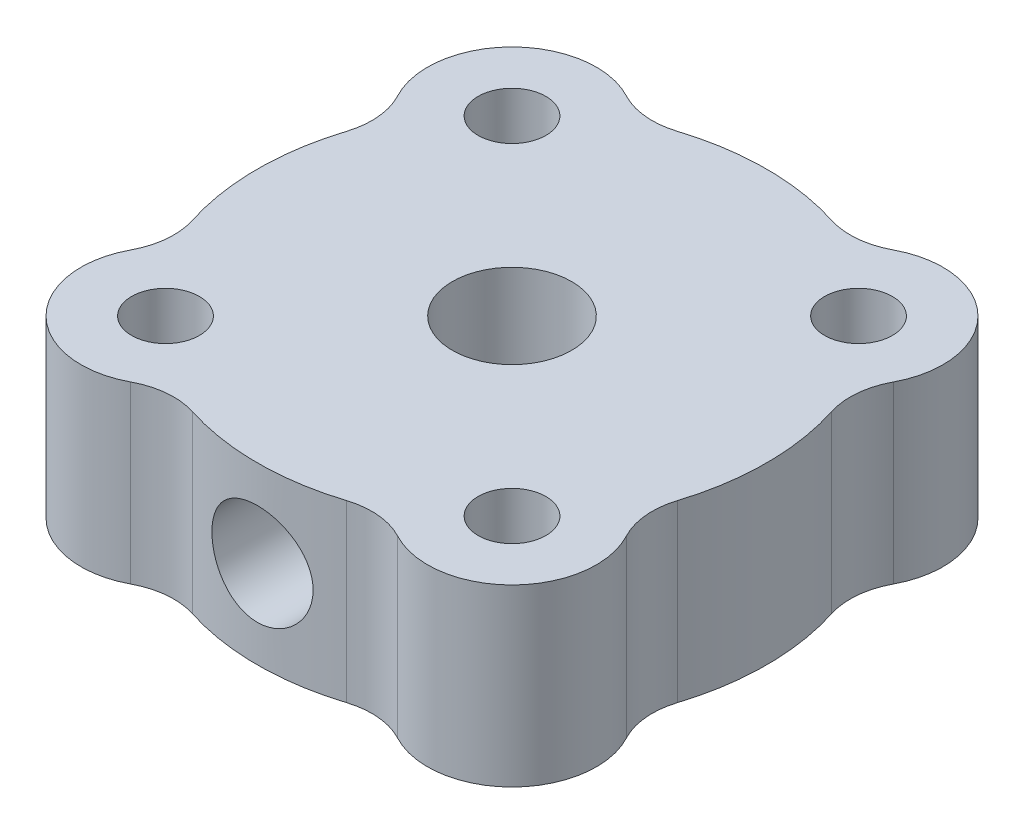
from build123d import *

# Parameters (mm, degrees)
BOSS_EXTRUDE1_DEPTH         = 6.985
BOSS_EXTRUDE2_DEPTH         = 6.985
BOSS_EXTRUDE3_DEPTH         = 6.985
BOSS_EXTRUDE4_START         = -6.985
BOSS_EXTRUDE4_DEPTH         = 6.985
SKETCH5_W                   = 6.35
SKETCH5_H                   = 2.54
M2_5_CLEARANCE_HOLE1_D      = 2.7051
M4_CLEARANCE_HOLE1_D        = 4.7625
M3_5_CLEARANCE_HOLE1_REACH  = 25.671
M3_5_CLEARANCE_HOLE1_BORE_R = 2.0193
FILLET1_R                   = 2.921


with BuildPart() as part:
    # Sketch1 → Boss-Extrude1 (new body)
    with BuildSketch(Plane.XZ.offset(-2.54)):
        with BuildLine():
            ThreePointArc((-4.397716486, 9.158913129), (-9.299304671, 9.299304671), (-9.158913129, 4.397716486))
            ThreePointArc((-9.158913129, 4.397716486), (7.184204897, -7.184204897), (-4.397716486, 9.158913129))
        make_face()
    extrude(amount=-BOSS_EXTRUDE1_DEPTH)

    # Sketch2 → Boss-Extrude2 (add)
    with BuildSketch(Plane.XZ.offset(-2.54)):
        with BuildLine():
            ThreePointArc((-9.158913129, -4.397716486), (-9.299304671, -9.299304671), (-4.397716486, -9.158913129))
            ThreePointArc((-4.397716486, -9.158913129), (-7.184204897, -7.184204897), (-9.158913129, -4.397716486))
        make_face()
    extrude(amount=-BOSS_EXTRUDE2_DEPTH)

    # Sketch3 → Boss-Extrude3 (add)
    with BuildSketch(Plane.XZ.offset(-2.54)):
        with BuildLine():
            ThreePointArc((4.397716486, -9.158913129), (9.299304671, -9.299304671), (9.158913129, -4.397716486))
            ThreePointArc((9.158913129, -4.397716486), (7.184204897, -7.184204897), (4.397716486, -9.158913129))
        make_face()
    extrude(amount=-BOSS_EXTRUDE3_DEPTH)

    # Sketch4 → Boss-Extrude4 (add)
    with BuildSketch(Plane(origin=(0, 9.525, 0), x_dir=(1, 0, 0), z_dir=(0, 1, 0)).offset(BOSS_EXTRUDE4_START)):
        with BuildLine():
            ThreePointArc((9.158913129, -4.397716486), (7.184204897, -7.184204897), (4.397716486, -9.158913129))
            ThreePointArc((4.397716486, -9.158913129), (9.299304671, -9.299304671), (9.158913129, -4.397716486))
        make_face()
    extrude(amount=BOSS_EXTRUDE4_DEPTH)

    # Sketch5 → Revolve1 (revolve)
    with BuildSketch(Plane.XY, mode=Mode.PRIVATE) as revolve1_sk:
        with Locations((3.175, 1.27)):
            Rectangle(SKETCH5_W, SKETCH5_H)
    revolve(revolve1_sk.sketch.rotate(Axis((0, 2.54, 0), (0, -1, 0)), 270), axis=Axis((0, 2.54, 0), (0, -1, 0)))

    # M2.5 Clearance Hole1 (through all)
    with Locations(Plane(origin=(0, 2.54, 0), x_dir=(-1, 0, 0), z_dir=(0, -1, 0))):
        with Locations((-6.914797213, 6.914797213), (-6.914797213, -6.914797213), (6.914797213, -6.914797213), (6.914797213, 6.914797213)):
            Hole(M2_5_CLEARANCE_HOLE1_D / 2)

    # M4 Clearance Hole1 (through all)
    with Locations(Plane(origin=(0, 0, 0), x_dir=(-1, 0, 0), z_dir=(0, -1, 0))):
        with Locations((0, 0)):
            Hole(M4_CLEARANCE_HOLE1_D / 2)

    # M3.5 Clearance Hole1 bore (on position points) → M3.5 Clearance Hole1 (cut, up to next)
    with BuildSketch(Plane(origin=(0, 6.0325, 10.16), x_dir=(1, 0, 0), z_dir=(0, 0, 1)), mode=Mode.PRIVATE) as m3_5_clearance_hole1_sk1:
        Circle(M3_5_CLEARANCE_HOLE1_BORE_R)
    m3_5_clearance_hole1_tool1 = extrude(m3_5_clearance_hole1_sk1.sketch, amount=-M3_5_CLEARANCE_HOLE1_REACH, mode=Mode.PRIVATE) & part.part
    add(m3_5_clearance_hole1_tool1.solids().sort_by_distance((0, 6.0325, 10.16))[0], mode=Mode.SUBTRACT)

    # Fillet1
    fillet1_edges = [part.edges().sort_by_distance(p)[0] for p in [
        (-9.158913129, 6.0325, -4.397716486),
        (-4.397716486, 6.0325, -9.158913129),
        (4.397716486, 6.0325, -9.158913129),
        (9.158913129, 6.0325, -4.397716486),
        (9.158913129, 6.0325, 4.397716486),
        (4.397716486, 6.0325, 9.158913129),
        (-9.158913129, 6.0325, 4.397716486),
        (-4.397716486, 6.0325, 9.158913129),
    ]]
    fillet(fillet1_edges, radius=FILLET1_R)


solid = part.part
